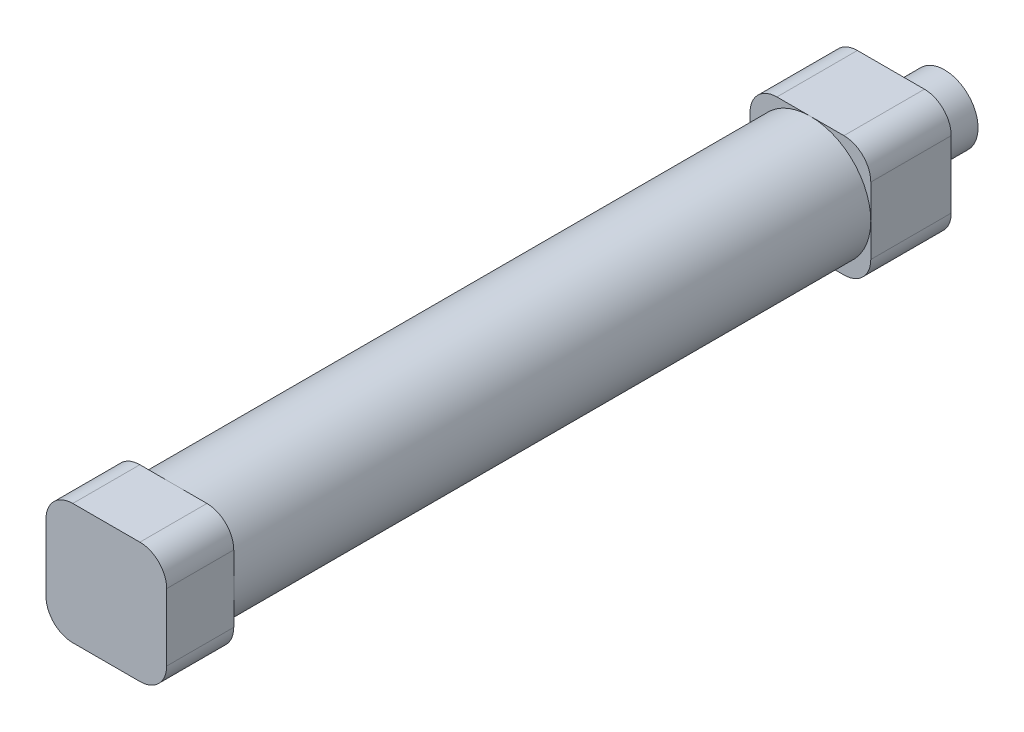
from build123d import *

# Parameters (mm, degrees)
SKETCH_1_R          = 9
SKETCH_1_R_2        = 8
EXTRUDE_1_DEPTH     = 95
EXTRUDE_2_DEPTH     = 10
EXTRUDE_START       = 12
EXTRUDE_3_DEPTH     = 12
SKETCH_4_R          = 5
EXTRUDE_4_DEPTH     = 8
SKETCH_5_R          = 2.5
CUT_EXTRUDE_1_DEPTH = 38
SKETCH_6_R          = 2
SKETCH_6_R_2        = 1.980516498
CUT_EXTRUDE_3_DEPTH = 3


with BuildPart() as part:
    # 草图1 → 凸台-拉伸1 (new body)
    with BuildSketch(Plane.XY):
        Circle(SKETCH_1_R)
        Circle(SKETCH_1_R_2, mode=Mode.SUBTRACT)
    extrude(amount=EXTRUDE_1_DEPTH)

    # 草图2 → 凸台-拉伸2 (add)
    with BuildSketch(Plane.XY.offset(95)):
        with BuildLine():
            Line((-5, -9), (5, -9))
            ThreePointArc((5, -9), (7.828427125, -7.828427125), (9, -5))
            Line((9, -5), (9, 5))
            ThreePointArc((9, 5), (7.828427125, 7.828427125), (5, 9))
            Line((5, 9), (-5, 9))
            ThreePointArc((-5, 9), (-7.828427125, 7.828427125), (-9, 5))
            Line((-9, 5), (-9, -5))
            ThreePointArc((-9, -5), (-7.828427125, -7.828427125), (-5, -9))
        make_face()
    extrude(amount=EXTRUDE_2_DEPTH)

    # 草图3 → 凸台-拉伸3 (add)
    with BuildSketch(Plane(origin=(0, 0, 0), x_dir=(-1, 0, 0), z_dir=(0, 0, -1)).offset(EXTRUDE_START)):
        with BuildLine():
            Line((-5, -9), (5, -9))
            ThreePointArc((5, -9), (7.828427125, -7.828427125), (9, -5))
            Line((9, -5), (9, 5))
            ThreePointArc((9, 5), (7.828427125, 7.828427125), (5, 9))
            Line((5, 9), (-5, 9))
            ThreePointArc((-5, 9), (-7.828427125, 7.828427125), (-9, 5))
            Line((-9, 5), (-9, -5))
            ThreePointArc((-9, -5), (-7.828427125, -7.828427125), (-5, -9))
        make_face()
    extrude(amount=-EXTRUDE_3_DEPTH)

    # 草图4 → 凸台-拉伸4 (add)
    with BuildSketch(Plane(origin=(0, 0, -12), x_dir=(-1, 0, 0), z_dir=(0, 0, -1))):
        Circle(SKETCH_4_R)
    extrude(amount=EXTRUDE_4_DEPTH)

    # 草图5 → 切除-拉伸1 (cut)
    with BuildSketch(Plane(origin=(0, 0, -20), x_dir=(-1, 0, 0), z_dir=(0, 0, -1))):
        Circle(SKETCH_5_R)
    extrude(amount=-CUT_EXTRUDE_1_DEPTH, mode=Mode.SUBTRACT)

    # 草图6 → 切除-拉伸3 (cut)
    with BuildSketch(Plane.ZY.offset(9)):
        with Locations((-4, 0)):
            Circle(SKETCH_6_R)
        with Locations((99, 0)):
            Circle(SKETCH_6_R_2)
    extrude(amount=-CUT_EXTRUDE_3_DEPTH, mode=Mode.SUBTRACT)


solid = part.part
